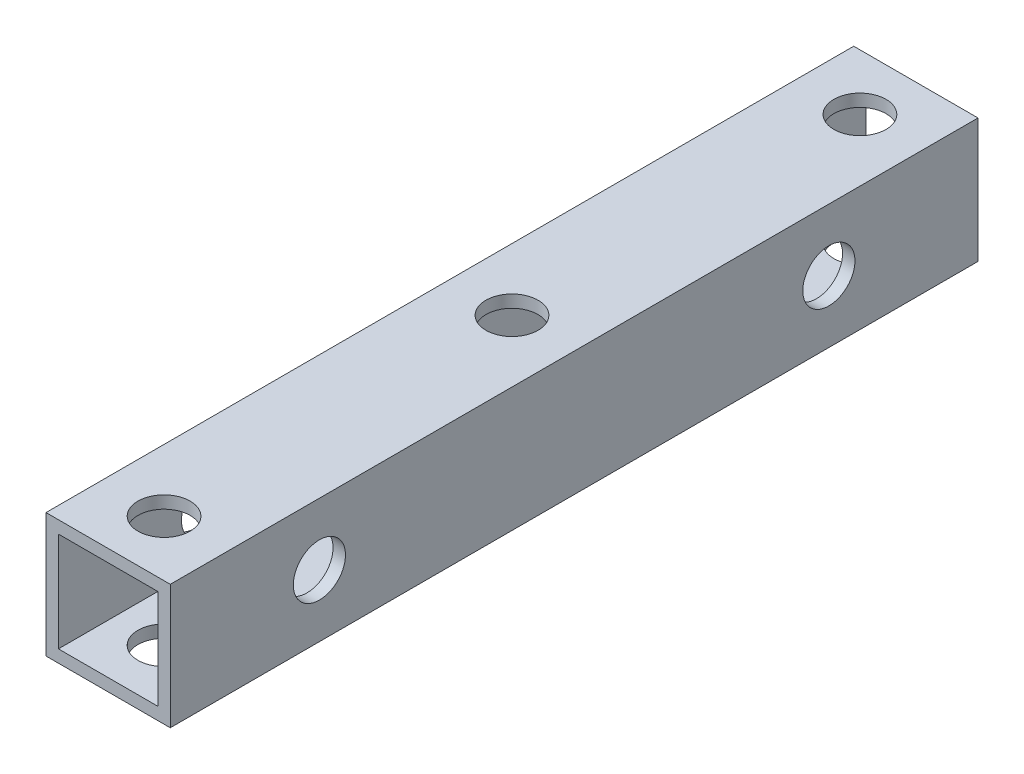
from build123d import *

# Parameters (mm, degrees)
SKETCH_1_W          = 10
SKETCH_1_H          = 10
SKETCH_1_W_2        = 8
SKETCH_1_H_2        = 8
EXTRUDE_1_DEPTH     = 65
SKETCH_2_R          = 2.1
CUT_EXTRUDE_1_DEPTH = 60
SKETCH_3_R          = 2.1
CUT_EXTRUDE_2_DEPTH = 66.954529791


with BuildPart() as part:
    # 草图1 → 凸台-拉伸1 (new body)
    with BuildSketch(Plane.XY):
        Rectangle(SKETCH_1_W, SKETCH_1_H)
        Rectangle(SKETCH_1_W_2, SKETCH_1_H_2, mode=Mode.SUBTRACT)
    extrude(amount=EXTRUDE_1_DEPTH)

    # 草图2 → 切除-拉伸1 (cut)
    with BuildSketch(Plane(origin=(0, 5, 0), x_dir=(1, 0, 0), z_dir=(0, 1, 0))):
        with Locations(Location((0, -4.5, 0), (0, 0, 270))):
            Circle(SKETCH_2_R)
        with Locations(Location((0, -32.5, 0), (0, 0, 270))):
            Circle(SKETCH_2_R)
    cut_extrude_1 = extrude(amount=-CUT_EXTRUDE_1_DEPTH, mode=Mode.SUBTRACT)

    # 镜向1: 切除-拉伸1 across plane
    add(cut_extrude_1.mirror(Plane(origin=(0, 0, 32.5), x_dir=(1, 0, 0), z_dir=(0, 0, -1))), mode=Mode.SUBTRACT)

    # 草图3 → 切除-拉伸2 (cut, through all)
    with BuildSketch(Plane.ZY.offset(5)):
        with Locations(Location((12, 0, 0), (0, 0, 270))):
            Circle(SKETCH_3_R)
    cut_extrude_2 = extrude(amount=-CUT_EXTRUDE_2_DEPTH, mode=Mode.SUBTRACT)

    # 镜向2: 切除-拉伸2 across plane
    add(cut_extrude_2.mirror(Plane(origin=(0, 0, 32.5), x_dir=(1, 0, 0), z_dir=(0, 0, -1))), mode=Mode.SUBTRACT)


solid = part.part
